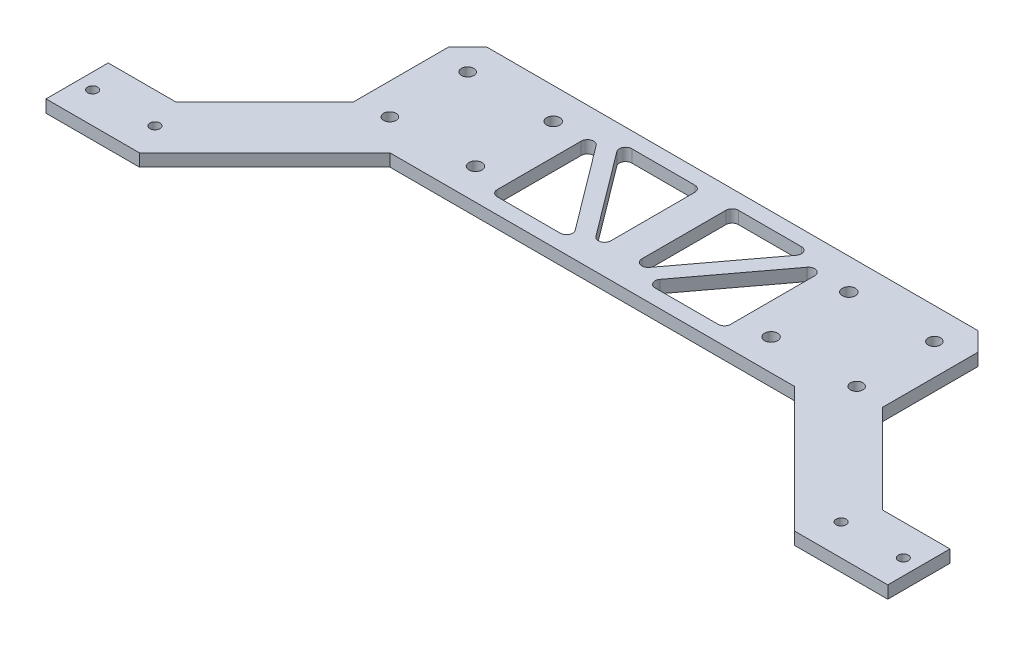
from build123d import *

# Parameters (mm, degrees)
SKETCH_1_W          = 170
SKETCH_1_H          = 45
SKETCH_1_R          = 2
SKETCH_1_R_2        = 2.1
EXTRUDE_1_DEPTH     = 4
EXTRUDE_2_DEPTH     = 4
CUT_EXTRUDE_1_DEPTH = 4
CUT_EXTRUDE_2_DEPTH = 4
FILLET_1_R          = 2
SKETCH_6_R          = 1.6
CUT_EXTRUDE_3_DEPTH = 50


with BuildPart() as part:
    # 草图1 → 凸台-拉伸1 (new body)
    with BuildSketch(Plane(origin=(0, 0, 0), x_dir=(1, 0, 0), z_dir=(0, 1, 0))):
        with Locations((85, 22.5)):
            Rectangle(SKETCH_1_W, SKETCH_1_H)
        with Locations(Location((10, 35, 0), (0, 0, 270))):
            Circle(SKETCH_1_R, mode=Mode.SUBTRACT)
        with Locations(Location((10, 10, 0), (0, 0, 270))):
            Circle(SKETCH_1_R, mode=Mode.SUBTRACT)
        with Locations(Location((160, 10, 0), (0, 0, 270))):
            Circle(SKETCH_1_R, mode=Mode.SUBTRACT)
        with Locations(Location((160, 35, 0), (0, 0, 270))):
            Circle(SKETCH_1_R, mode=Mode.SUBTRACT)
        with Locations(Location((37.5, 35, 0), (0, 0, 270))):
            Circle(SKETCH_1_R_2, mode=Mode.SUBTRACT)
        with Locations(Location((37.5, 10, 0), (0, 0, 270))):
            Circle(SKETCH_1_R_2, mode=Mode.SUBTRACT)
        with Locations(Location((132.5, 10, 0), (0, 0, 270))):
            Circle(SKETCH_1_R_2, mode=Mode.SUBTRACT)
        with Locations(Location((132.5, 35, 0), (0, 0, 270))):
            Circle(SKETCH_1_R_2, mode=Mode.SUBTRACT)
    extrude(amount=EXTRUDE_1_DEPTH)

    # 草图2 → 凸台-拉伸2 (add)
    with BuildSketch(Plane(origin=(0, 0, 0), x_dir=(1, 0, 0), z_dir=(0, 1, 0))):
        Polygon((170, 8.284271247), (198.534271247, -20.25), (220.25, -20.25), (220.25, -40.25), (190.25, -40.25), (150, 0), (170, 0), align=None)
        Polygon((-50.25, -40.25), (-20.25, -40.25), (20, 0), (0, 0), (0, 8.284271247), (-28.534271247, -20.25), (-50.25, -20.25), align=None)
    extrude(amount=EXTRUDE_2_DEPTH)

    # 草图4 → 切除-拉伸1 (cut)
    with BuildSketch(Plane(origin=(0, 4, 0), x_dir=(1, 0, 0), z_dir=(0, 1, 0))):
        Polygon((0, 38.909451479), (6, 45), (0, 45), align=None)
        Polygon((170, 39), (164, 45), (170, 45), align=None)
    extrude(amount=-CUT_EXTRUDE_1_DEPTH, mode=Mode.SUBTRACT)

    # 草图5 → 切除-拉伸2 (cut)
    with BuildSketch(Plane.XZ):
        Polygon((47.5, -5), (47.5, -40), (73.75, -5), align=None)
        Polygon((53.75, -40), (80, -5), (80, -40), align=None)
        Polygon((90, -5), (90, -40), (116.25, -40), align=None)
        Polygon((96.25, -5), (122.5, -5), (122.5, -40), align=None)
    extrude(amount=-CUT_EXTRUDE_2_DEPTH, mode=Mode.SUBTRACT)

    # 圆角1
    fillet_1_edges = [part.edges().sort_by_distance(p)[0] for p in [
        (80, 2, -5),
        (53.75, 2, -40),
        (80, 2, -40),
        (90, 2, -40),
        (116.25, 2, -40),
        (90, 2, -5),
        (122.5, 2, -5),
        (96.25, 2, -5),
        (122.5, 2, -40),
        (47.5, 2, -40),
        (73.75, 2, -5),
        (47.5, 2, -5),
    ]]
    fillet(fillet_1_edges, radius=FILLET_1_R)

    # 草图6 → 切除-拉伸3 (cut)
    with BuildSketch(Plane.XZ):
        with Locations(Location((-45.25, 30.25, 0), (0, 0, 270))):
            Circle(SKETCH_6_R)
        with Locations(Location((-25.25, 30.25, 0), (0, 0, 270))):
            Circle(SKETCH_6_R)
        with Locations(Location((195.25, 30.25, 0), (0, 0, 90))):
            Circle(SKETCH_6_R)
        with Locations(Location((215.25, 30.25, 0), (0, 0, 90))):
            Circle(SKETCH_6_R)
    extrude(amount=-CUT_EXTRUDE_3_DEPTH, mode=Mode.SUBTRACT)


solid = part.part
